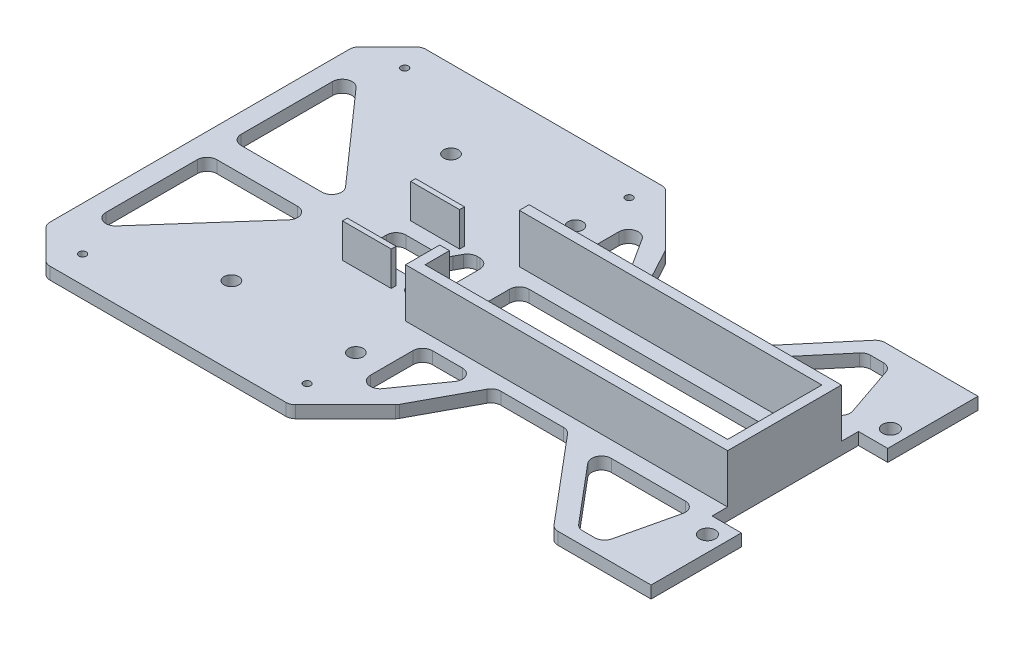
from build123d import *

# Parameters (mm, degrees)
BOSS_EXTRUDE1_DEPTH = 2.5
SKETCH2_R           = 1.6
CUT_EXTRUDE1_DEPTH  = 2.5
SKETCH3_R           = 0.75
CUT_EXTRUDE2_DEPTH  = 2.5
SKETCH4_W           = 6
SKETCH4_H           = 30
CUT_EXTRUDE3_DEPTH  = 10
SKETCH5_R           = 1.5
CUT_EXTRUDE4_DEPTH  = 10
BOSS_EXTRUDE2_DEPTH = 10
SKETCH7_W           = 10
SKETCH7_H           = 1
BOSS_EXTRUDE3_DEPTH = 7
SKETCH8_W           = 56
SKETCH8_H           = 13.315108835
CUT_EXTRUDE5_DEPTH  = 7
FILLET1_R           = 2
CUT_EXTRUDE6_DEPTH  = 7
FILLET3_R           = 2
CUT_EXTRUDE7_DEPTH  = 7
FILLET6_R           = 2
CUT_EXTRUDE8_DEPTH  = 7
FILLET7_R           = 2
CUT_EXTRUDE9_DEPTH  = 7
FILLET8_R           = 2
FILLET9_R           = 2


with BuildPart() as part:
    # Sketch1 → Boss-Extrude1 (new body)
    with BuildSketch(Plane(origin=(0, 0, 0), x_dir=(1, 0, 0), z_dir=(0, 1, 0))):
        Polygon((-10, 33.683794085), (10, 33.683794085), (10, -33.316205915), (-10, -33.316205915), (-26, -14.316205915), (-41, -14.316205915), (-48, -27.316205915), (-59, -38.316205915), (-109, -38.316205915), (-116, -31.316205915), (-116, 31.683794085), (-109, 38.683794085), (-59, 38.683794085), (-48, 27.683794085), (-41, 14.683794085), (-26, 14.683794085), align=None)
    extrude(amount=BOSS_EXTRUDE1_DEPTH)

    # Sketch2 → Cut-Extrude1 (cut)
    with BuildSketch(Plane(origin=(0, 2.5, 0), x_dir=(1, 0, 0), z_dir=(0, 1, 0))):
        with Locations(Location((6.8, 18.933794085, 0), (0, 0, 270))):
            Circle(SKETCH2_R)
        with Locations(Location((6.8, -18.566205915, 0), (0, 0, 270))):
            Circle(SKETCH2_R)
    extrude(amount=-CUT_EXTRUDE1_DEPTH, mode=Mode.SUBTRACT)

    # Sketch3 → Cut-Extrude2 (cut)
    with BuildSketch(Plane(origin=(0, 2.5, 0), x_dir=(1, 0, 0), z_dir=(0, 1, 0))):
        with Locations(Location((-107, 33.183794085, 0), (0, 0, 270))):
            Circle(SKETCH3_R)
        with Locations(Location((-61, 33.183794085, 0), (0, 0, 270))):
            Circle(SKETCH3_R)
        with Locations(Location((-61, -32.816205915, 0), (0, 0, 270))):
            Circle(SKETCH3_R)
        with Locations(Location((-107, -32.816205915, 0), (0, 0, 270))):
            Circle(SKETCH3_R)
    extrude(amount=-CUT_EXTRUDE2_DEPTH, mode=Mode.SUBTRACT)

    # Sketch4 → Cut-Extrude3 (cut)
    with BuildSketch(Plane(origin=(0, 2.5, 0), x_dir=(1, 0, 0), z_dir=(0, 1, 0))):
        with Locations((7, 0.183794085)):
            Rectangle(SKETCH4_W, SKETCH4_H)
    extrude(amount=-CUT_EXTRUDE3_DEPTH, mode=Mode.SUBTRACT)

    # Sketch5 → Cut-Extrude4 (cut)
    with BuildSketch(Plane(origin=(0, 2.5, 0), x_dir=(1, 0, 0), z_dir=(0, 1, 0))):
        with Locations(Location((-87, 22.683794085, 0), (0, 0, 270))):
            Circle(SKETCH5_R)
        with Locations(Location((-61.5, 22.683794085, 0), (0, 0, 270))):
            Circle(SKETCH5_R)
        with Locations(Location((-61.5, -22.316205915, 0), (0, 0, 270))):
            Circle(SKETCH5_R)
        with Locations(Location((-87, -22.316205915, 0), (0, 0, 270))):
            Circle(SKETCH5_R)
    extrude(amount=-CUT_EXTRUDE4_DEPTH, mode=Mode.SUBTRACT)

    # Sketch6 → Boss-Extrude2 (add)
    with BuildSketch(Plane(origin=(0, 2.5, 0), x_dir=(1, 0, 0), z_dir=(0, 1, 0))):
        Polygon((4, -11.63131475), (-62, -11.63131475), (-62, -4.63131475), (-60, -4.63131475), (-60, -9.63131475), (2, -9.63131475), (2, 9.683794085), (-60, 9.683794085), (-60, 11.683794085), (4, 11.683794085), align=None)
    extrude(amount=BOSS_EXTRUDE2_DEPTH)

    # Sketch7 → Boss-Extrude3 (add)
    with BuildSketch(Plane(origin=(0, 2.5, 0), x_dir=(1, 0, 0), z_dir=(0, 1, 0))):
        with Locations((-74.25, 7.183794085)):
            Rectangle(SKETCH7_W, SKETCH7_H)
        with Locations((-74.25, -6.816205915)):
            Rectangle(SKETCH7_W, SKETCH7_H)
    extrude(amount=BOSS_EXTRUDE3_DEPTH)

    # Sketch8 → Cut-Extrude5 (cut)
    with BuildSketch(Plane(origin=(0, 2.5, 0), x_dir=(1, 0, 0), z_dir=(0, 1, 0))):
        with Locations((-29, 0.026239668)):
            Rectangle(SKETCH8_W, SKETCH8_H)
    extrude(amount=-CUT_EXTRUDE5_DEPTH, mode=Mode.SUBTRACT)

    # Fillet1
    fillet1_edges = [part.edges().sort_by_distance(p)[0] for p in [
        (-10, 1.25, 33.316205915),
        (-26, 1.25, 14.316205915),
        (-41, 1.25, 14.316205915),
        (-48, 1.25, 27.316205915),
        (-59, 1.25, 38.316205915),
        (-109, 1.25, 38.316205915),
        (-116, 1.25, 31.316205915),
        (-116, 1.25, -31.683794085),
        (-109, 1.25, -38.683794085),
        (-59, 1.25, -38.683794085),
        (-48, 1.25, -27.683794085),
        (-41, 1.25, -14.683794085),
        (-26, 1.25, -14.683794085),
        (-10, 1.25, -33.683794085),
    ]]
    fillet(fillet1_edges, radius=FILLET1_R)

    # Sketch9 → Cut-Extrude6 (cut)
    with BuildSketch(Plane(origin=(0, 2.5, 0), x_dir=(1, 0, 0), z_dir=(0, 1, 0))):
        Polygon((-79.25, 3.683794085), (-79.25, -3.316205915), (-69.25, -3.316205915), (-67.358162245, -6.816205915), (-63.608162245, -6.816205915), (-63.608162245, 7.183794085), (-67.358162245, 7.183794085), (-69.25, 3.683794085), align=None)
    extrude(amount=-CUT_EXTRUDE6_DEPTH, mode=Mode.SUBTRACT)

    # Fillet3
    fillet3_edges = [part.edges().sort_by_distance(p)[0] for p in [
        (-79.25, 1.25, -3.683794085),
        (-69.25, 1.25, -3.683794085),
        (-67.358162245, 1.25, -7.183794085),
        (-63.608162245, 1.25, -7.183794085),
        (-63.608162245, 1.25, 6.816205915),
        (-67.358162245, 1.25, 6.816205915),
        (-69.25, 1.25, 3.316205915),
        (-79.25, 1.25, 3.316205915),
    ]]
    fillet(fillet3_edges, radius=FILLET3_R)

    # Sketch10 → Cut-Extrude7 (cut)
    with BuildSketch(Plane(origin=(0, 2.5, 0), x_dir=(1, 0, 0), z_dir=(0, 1, 0))):
        Polygon((-44, -14.13131475), (-56, -14.13131475), (-56, -31.14037523), align=None)
        Polygon((-44, 14.183794085), (-56, 14.183794085), (-56, 32.891774512), align=None)
    extrude(amount=-CUT_EXTRUDE7_DEPTH, mode=Mode.SUBTRACT)

    # Fillet6
    fillet6_edges = [part.edges().sort_by_distance(p)[0] for p in [
        (-44, 1.25, 14.13131475),
        (-56, 1.25, 31.14037523),
        (-56, 1.25, 14.13131475),
        (-56, 1.25, -32.891774512),
        (-44, 1.25, -14.183794085),
        (-56, 1.25, -14.183794085),
    ]]
    fillet(fillet6_edges, radius=FILLET6_R)

    # Sketch11 → Cut-Extrude8 (cut)
    with BuildSketch(Plane(origin=(0, 2.5, 0), x_dir=(1, 0, 0), z_dir=(0, 1, 0))):
        Polygon((-4.220314933, 29.952266722), (-9.220314933, 29.952266722), (-21.314371027, 15.59057511), (0.685628973, 15.59057511), align=None)
        Polygon((-20.861245147, -14.911119692), (1.138754853, -14.911119692), (-2.563588823, -30.702086576), (-7.563588823, -30.702086576), align=None)
    extrude(amount=-CUT_EXTRUDE8_DEPTH, mode=Mode.SUBTRACT)

    # Fillet7
    fillet7_edges = [part.edges().sort_by_distance(p)[0] for p in [
        (-4.220314933, 1.25, -29.952266722),
        (0.685628973, 1.25, -15.59057511),
        (-21.314371027, 1.25, -15.59057511),
        (-9.220314933, 1.25, -29.952266722),
        (-7.563588823, 1.25, 30.702086576),
        (-20.861245147, 1.25, 14.911119692),
        (1.138754853, 1.25, 14.911119692),
        (-2.563588823, 1.25, 30.702086576),
    ]]
    fillet(fillet7_edges, radius=FILLET7_R)

    # Sketch12 → Cut-Extrude9 (cut)
    with BuildSketch(Plane(origin=(0, 2.5, 0), x_dir=(1, 0, 0), z_dir=(0, 1, 0))):
        Polygon((-112, 28.683794085), (-112, 2.683794085), (-89, 2.683794085), align=None)
        Polygon((-112, -2.316205915), (-112, -28.316205915), (-89, -2.316205915), align=None)
    extrude(amount=-CUT_EXTRUDE9_DEPTH, mode=Mode.SUBTRACT)

    # Fillet8
    fillet8_edges = [part.edges().sort_by_distance(p)[0] for p in [
        (-112, 1.25, -28.683794085),
        (-89, 1.25, -2.683794085),
        (-112, 1.25, -2.683794085),
        (-112, 1.25, 2.316205915),
        (-89, 1.25, 2.316205915),
        (-112, 1.25, 28.316205915),
    ]]
    fillet(fillet8_edges, radius=FILLET8_R)

    # Fillet9
    fillet9_edges = [part.edges().sort_by_distance(p)[0] for p in [
        (-57, 1.25, 6.63131475),
        (-57, 1.25, -6.683794085),
        (-1, 1.25, -6.683794085),
        (-1, 1.25, 6.63131475),
    ]]
    fillet(fillet9_edges, radius=FILLET9_R)


solid = part.part
